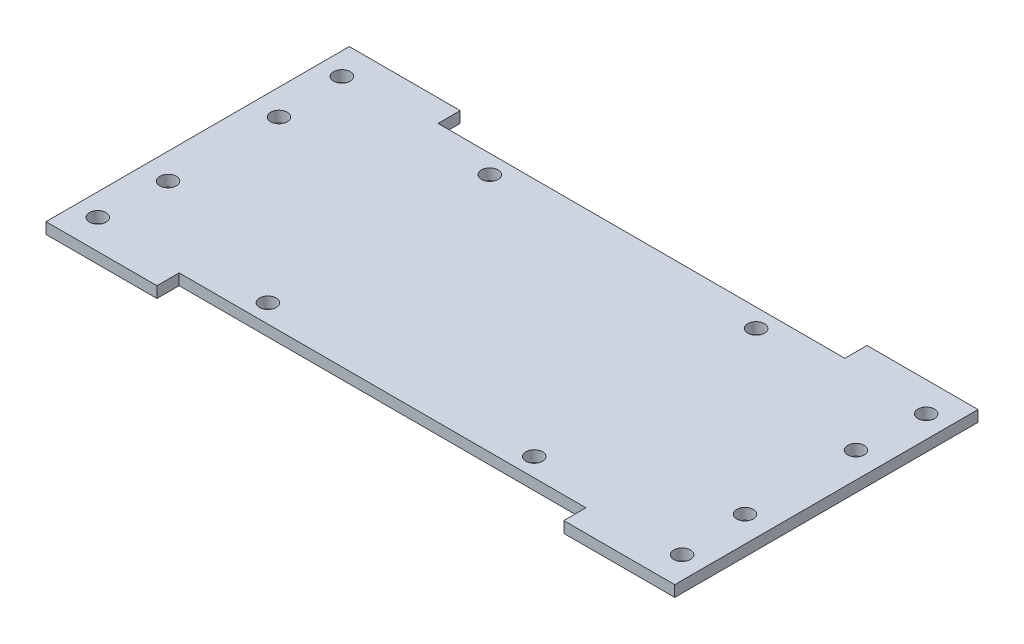
from build123d import *

# Parameters (mm, degrees)
SKETCH1_W           = 55
SKETCH1_H           = 35
BOSS_EXTRUDE1_DEPTH = 1.5
SKETCH2_W           = 15
SKETCH2_H           = 41
BOSS_EXTRUDE2_DEPTH = 1.5
SKETCH3_R           = 1.125
CUT_EXTRUDE1_DEPTH  = 10


with BuildPart() as part:
    # Sketch1 → Boss-Extrude1 (new body)
    with BuildSketch(Plane(origin=(0, 0, 0), x_dir=(1, 0, 0), z_dir=(0, 1, 0))):
        Rectangle(SKETCH1_W, SKETCH1_H)
    extrude(amount=BOSS_EXTRUDE1_DEPTH)

    # Sketch2 → Boss-Extrude2 (add)
    with BuildSketch(Plane(origin=(0, 0, 0), x_dir=(1, 0, 0), z_dir=(0, 1, 0))):
        with Locations((35, 0)):
            Rectangle(SKETCH2_W, SKETCH2_H)
        with Locations((-35, 0)):
            Rectangle(SKETCH2_W, SKETCH2_H)
    extrude(amount=BOSS_EXTRUDE2_DEPTH)

    # Sketch3 → Cut-Extrude1 (cut)
    with BuildSketch(Plane(origin=(0, 0, 0), x_dir=(1, 0, 0), z_dir=(0, 1, 0))):
        with Locations(Location((-39.5, -16.5, 0), (0, 0, 270))):
            Circle(SKETCH3_R)
        with Locations(Location((-39, -7.5, 0), (0, 0, 270))):
            Circle(SKETCH3_R)
        with Locations(Location((-39, 7.5, 0), (0, 0, 270))):
            Circle(SKETCH3_R)
        with Locations(Location((-39.5, 16.5, 0), (0, 0, 270))):
            Circle(SKETCH3_R)
        with Locations(Location((-18, 15, 0), (0, 0, 270))):
            Circle(SKETCH3_R)
        with Locations(Location((18, 15, 0), (0, 0, 270))):
            Circle(SKETCH3_R)
        with Locations(Location((-18, -15, 0), (0, 0, 270))):
            Circle(SKETCH3_R)
        with Locations(Location((18, -15, 0), (0, 0, 270))):
            Circle(SKETCH3_R)
    cut_extrude1 = extrude(amount=CUT_EXTRUDE1_DEPTH, mode=Mode.SUBTRACT)

    # Mirror1: Cut-Extrude1 across plane
    add(cut_extrude1.mirror(Plane(origin=(0, 0, 0), x_dir=(0, 0, 1), z_dir=(1, 0, 0))), mode=Mode.SUBTRACT)


solid = part.part
